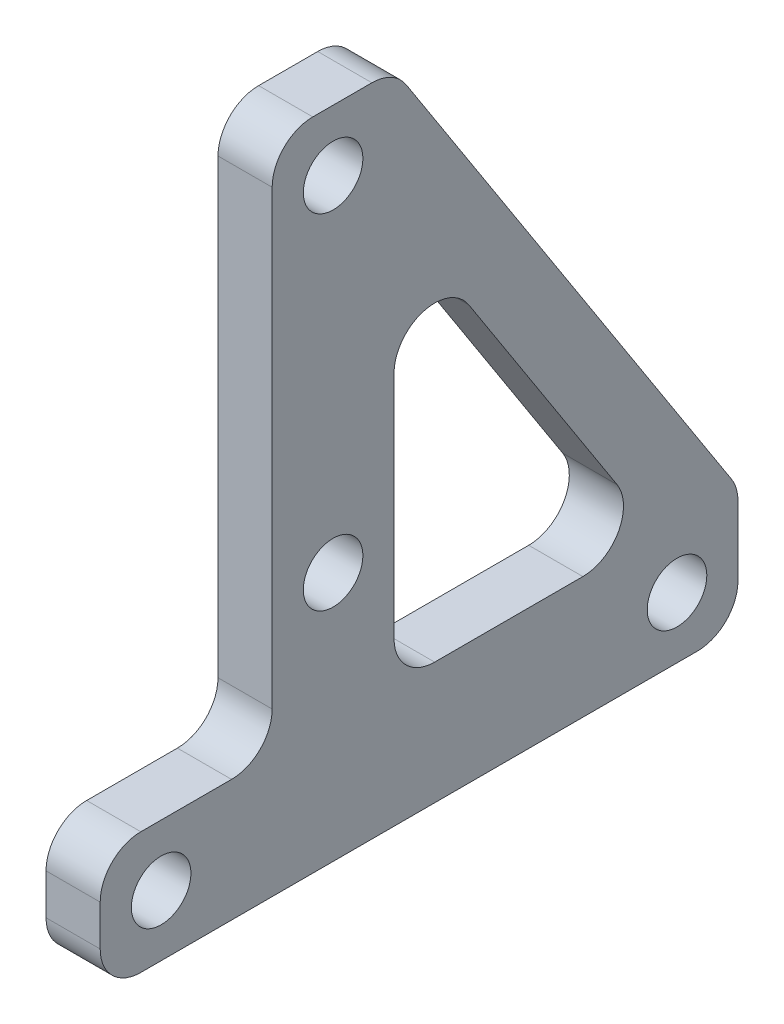
from build123d import *

# Parameters (mm, degrees)
SKETCH1_R           = 2.2
BOSS_EXTRUDE1_DEPTH = 4
FILLET1_R           = 3
SKETCH2_W           = 4.6228
SKETCH2_H           = 4.6228
BOSS_EXTRUDE2_DEPTH = 2
FILLET2_R           = 0.508
FILLET3_R           = 0.508


with BuildPart() as part:
    # Sketch1 → Boss-Extrude1 (new body)
    with BuildSketch(Plane(origin=(0, 0, 0), x_dir=(0, 0, -1), z_dir=(1, 0, 0))):
        Polygon((-4.5, 4.5), (-17.2, 4.5), (-17.2, -4.5), (29.9, -4.5), (29.9, 4.5), (4.5, 43.87), (-4.5, 43.87), align=None)
        with Locations((25.4, 0)):
            Circle(SKETCH1_R, mode=Mode.SUBTRACT)
        with Locations((0, 13.97)):
            Circle(SKETCH1_R, mode=Mode.SUBTRACT)
        with Locations((0, 39.37)):
            Circle(SKETCH1_R, mode=Mode.SUBTRACT)
        with Locations((-12.7, 0)):
            Circle(SKETCH1_R, mode=Mode.SUBTRACT)
        Polygon((4.5, 4.5), (23.949720405, 4.5), (4.5, 34.647066627), align=None, mode=Mode.SUBTRACT)
    extrude(amount=BOSS_EXTRUDE1_DEPTH)

    # Fillet1
    fillet1_edges = [part.edges().sort_by_distance(p)[0] for p in [
        (2, 43.87, 4.5),
        (2, 43.87, -4.5),
        (2, 4.5, -29.9),
        (2, -4.5, -29.9),
        (2, -4.5, 17.2),
        (2, 4.5, 17.2),
        (2, 4.5, 4.5),
        (2, 34.647066627, -4.5),
        (2, 4.5, -4.5),
        (2, 4.5, -23.949720405),
    ]]
    fillet(fillet1_edges, radius=FILLET1_R)

    # Sketch2 → Boss-Extrude2 (add)
    with BuildSketch(Plane(origin=(0, 0, 0), x_dir=(0, 0, -1), z_dir=(1, 0, 0))):
        Rectangle(SKETCH2_W, SKETCH2_H)
        with Locations((12.7, 0)):
            Rectangle(SKETCH2_W, SKETCH2_H)
        with Locations((0, 26.67)):
            Rectangle(SKETCH2_W, SKETCH2_H)
    extrude(amount=-BOSS_EXTRUDE2_DEPTH)

    # Fillet2
    fillet2_edges = [part.edges().sort_by_distance(p)[0] for p in [
        (-1, -2.3114, 2.3114),
        (-1, 2.3114, 2.3114),
        (-1, 2.3114, -2.3114),
        (-1, -2.3114, -2.3114),
        (-1, -2.3114, -10.3886),
        (-1, 2.3114, -10.3886),
        (-1, 2.3114, -15.0114),
        (-1, -2.3114, -15.0114),
        (-1, 28.9814, -2.3114),
        (-1, 24.3586, -2.3114),
        (-1, 24.3586, 2.3114),
        (-1, 28.9814, 2.3114),
    ]]
    fillet(fillet2_edges, radius=FILLET2_R)

    # Fillet3
    fillet3_edges = [part.edges().sort_by_distance(p)[0] for p in [
        (-2, 0, -15.0114),
        (-2, 2.3114, -12.7),
        (-2, 0, -10.3886),
        (-2, -2.3114, -12.7),
        (-2, -2.162610245, -14.862610245),
        (-2, -2.162610245, -10.537389755),
        (-2, 2.162610245, -10.537389755),
        (-2, 2.162610245, -14.862610245),
        (-2, -2.3114, 0),
        (-2, 0, -2.3114),
        (-2, 0, 2.3114),
        (-2, 2.3114, 0),
        (-2, -2.162610245, 2.162610245),
        (-2, 2.162610245, 2.162610245),
        (-2, 2.162610245, -2.162610245),
        (-2, -2.162610245, -2.162610245),
        (-2, 28.9814, 0),
        (-2, 26.67, 2.3114),
        (-2, 26.67, -2.3114),
        (-2, 24.3586, 0),
        (-2, 24.507389755, 2.162610245),
        (-2, 24.507389755, -2.162610245),
        (-2, 28.832610245, -2.162610245),
        (-2, 28.832610245, 2.162610245),
    ]]
    fillet(fillet3_edges, radius=FILLET3_R)


solid = part.part
